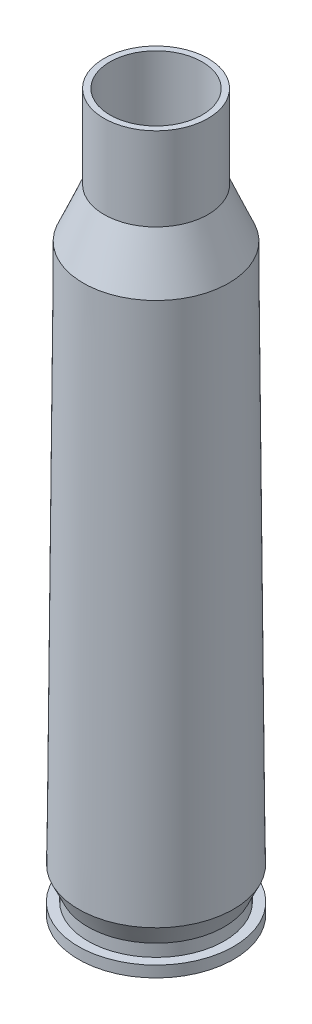
from build123d import *


with BuildPart() as part:
    # Esquisse1 → Révolution1 (revolve)
    with BuildSketch(Plane.XY):
        Polygon((-2.85, 39.441233286), (-2.85, 44.7), (-3.215, 44.7), (-3.215, 39.55), (-4.5, 36.52), (-4.79, 3.13), (-4.21644158, 1.9), (-4.21644158, 1.14), (-4.8, 1.14), (-4.8, 0.45), (-4.157333397, 0), (0, 0), (0, 1.14), (-3.368468441, 1.14), (-3.368468441, 1.9), (-3.94202686, 3.13), (-3.94202686, 36.321433458), align=None)
    revolve(axis=Axis((0, 0, 0), (0, 1, 0)))


solid = part.part
